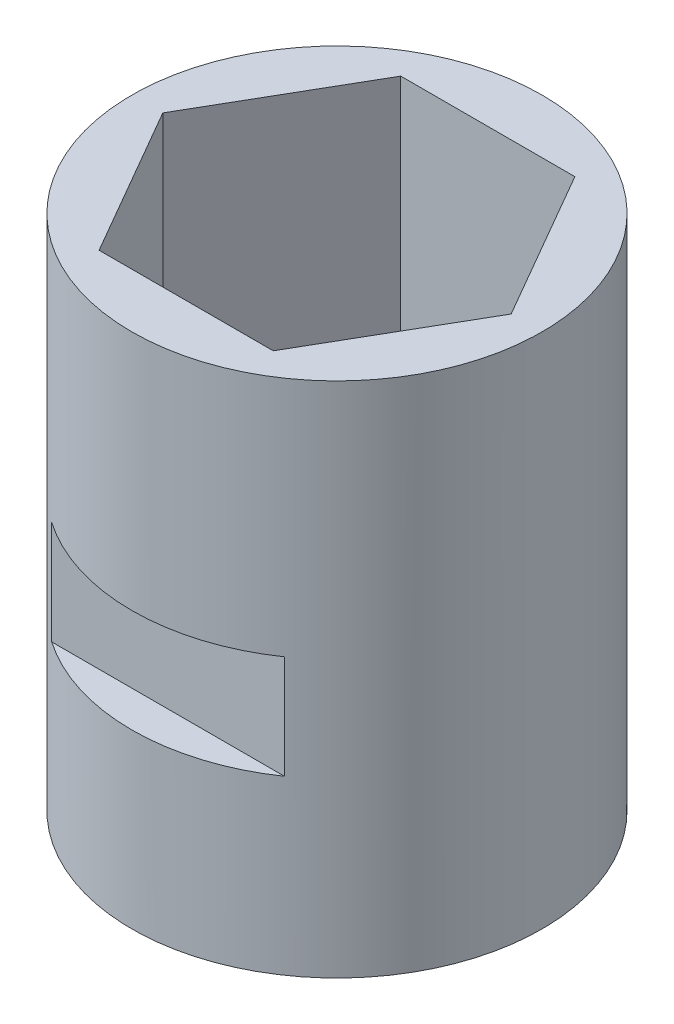
from build123d import *

# Parameters (mm, degrees)
SKETCH1_R               = 7.5565
BOSS_EXTRUDE1_DEPTH     = 15.875
BOSS_EXTRUDE2_START     = 3.175
SKETCH2_R               = 7.5565
SKETCH2_R_2             = 3.3782
BOSS_EXTRUDE2_DEPTH     = 3.175
CUT_EXTRUDE1_DEPTH      = 20.136797263
CUT_EXTRUDE1_DEPTH_BACK = 20.136797263
SKETCH3_W               = 1.979009817
SKETCH3_H               = 3.81
SKETCH3_W_2             = 2.256055482


with BuildPart() as part:
    # Sketch1 → Boss-Extrude1 (new body)
    with BuildSketch(Plane(origin=(0, 0, 0), x_dir=(1, 0, 0), z_dir=(0, 1, 0))):
        with Locations(Location((0, 0, 0), (0, 0, 270))):
            Circle(SKETCH1_R)
        Polygon((-3.207902433, 5.55625), (-6.415804866, 0), (-3.207902433, -5.55625), (3.207902433, -5.55625), (6.415804866, 0), (3.207902433, 5.55625), align=None, mode=Mode.SUBTRACT)
    extrude(amount=BOSS_EXTRUDE1_DEPTH)

    # Sketch2 → Boss-Extrude2 (add)
    with BuildSketch(Plane.XZ.offset(BOSS_EXTRUDE2_START)):
        with Locations(Location((0, 0, 0), (0, 0, 270))):
            Circle(SKETCH2_R)
        with Locations(Location((0, 0, 0), (0, 0, 270))):
            Circle(SKETCH2_R_2, mode=Mode.SUBTRACT)
    extrude(amount=-BOSS_EXTRUDE2_DEPTH)

    # Sketch3 → Cut-Extrude1 (cut, two sides: drawn at the far end of the back side and taken through both)
    with BuildSketch(Plane(origin=(0, 0, 0), x_dir=(0, 0, -1), z_dir=(1, 0, 0)).offset(-CUT_EXTRUDE1_DEPTH_BACK)):
        with Locations((-7.212504909, 5.08)):
            Rectangle(SKETCH3_W, SKETCH3_H)
        with Locations((7.351027741, 5.08)):
            Rectangle(SKETCH3_W_2, SKETCH3_H)
    extrude(amount=CUT_EXTRUDE1_DEPTH + CUT_EXTRUDE1_DEPTH_BACK, mode=Mode.SUBTRACT)


solid = part.part
